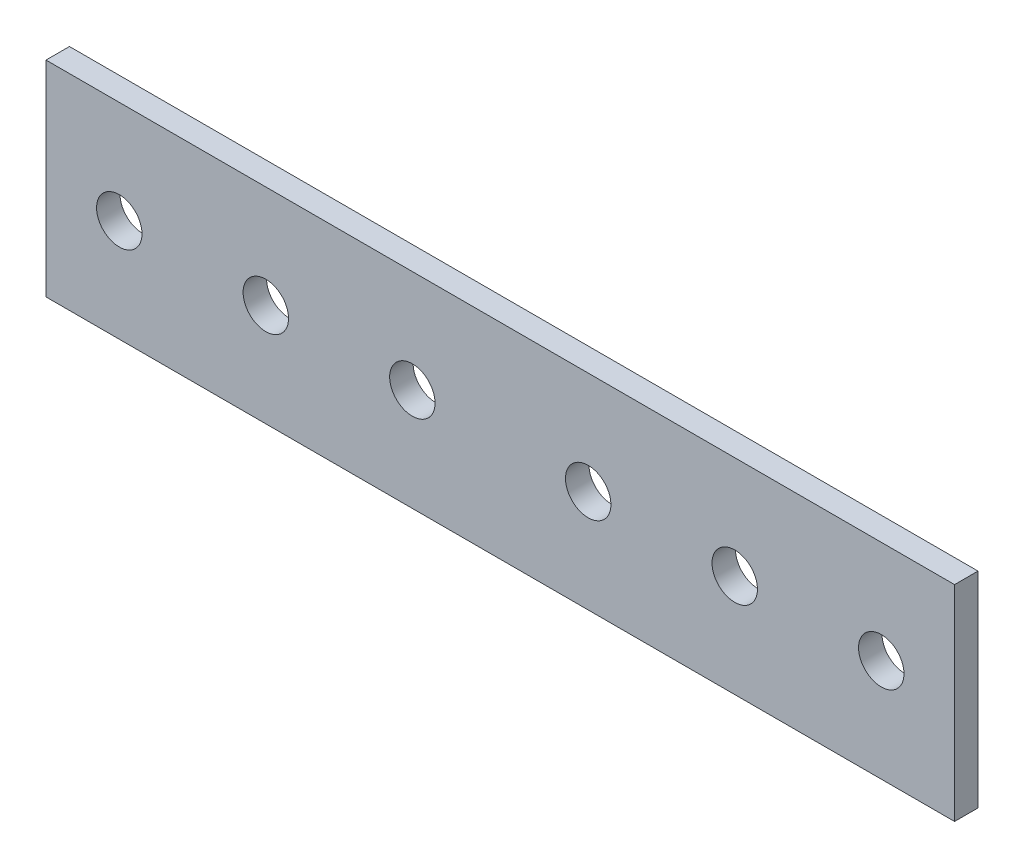
from build123d import *

# Parameters (mm, degrees)
SKETCH_1_W      = 620
SKETCH_1_H      = 140
SKETCH_1_R      = 15.5
EXTRUDE_1_DEPTH = 16


with BuildPart() as part:
    # 草图1 → 拉伸1 (new body)
    with BuildSketch(Plane.XY):
        with Locations((265.090705794, 54.021841155)):
            Rectangle(SKETCH_1_W, SKETCH_1_H)
        with Locations((5.090705794, 54.021841155)):
            Circle(SKETCH_1_R, mode=Mode.SUBTRACT)
        with Locations((205.090705794, 54.021841155)):
            Circle(SKETCH_1_R, mode=Mode.SUBTRACT)
        with Locations((105.090705794, 54.021841155)):
            Circle(SKETCH_1_R, mode=Mode.SUBTRACT)
        with Locations(Location((425.090705794, 54.021841155, 0), (0, 0, 180))):
            Circle(SKETCH_1_R, mode=Mode.SUBTRACT)
        with Locations(Location((325.090705794, 54.021841155, 0), (0, 0, 180))):
            Circle(SKETCH_1_R, mode=Mode.SUBTRACT)
        with Locations(Location((525.090705794, 54.021841155, 0), (0, 0, 180))):
            Circle(SKETCH_1_R, mode=Mode.SUBTRACT)
    extrude(amount=EXTRUDE_1_DEPTH)


solid = part.part
